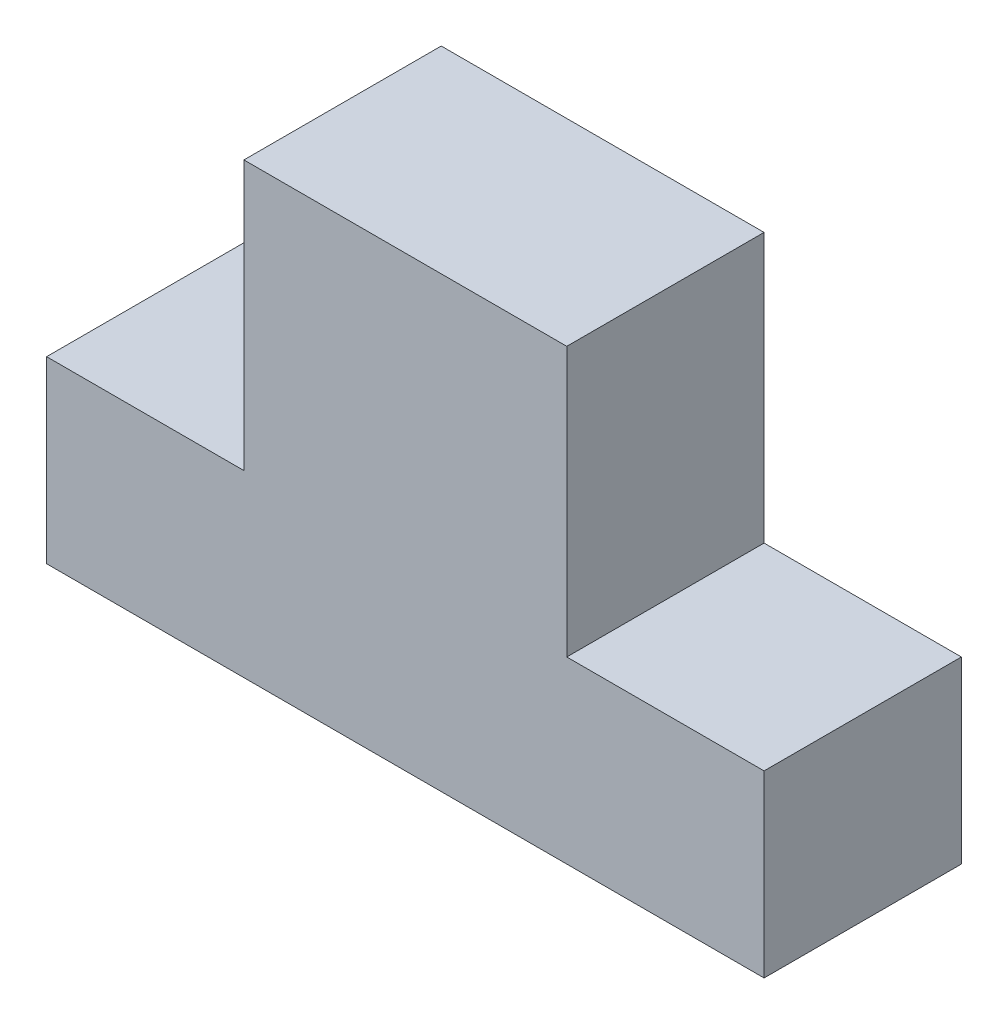
from build123d import *

# Parameters (mm, degrees)
EXTRUDE_1_DEPTH = 5.5


with BuildPart() as part:
    # ｽｹｯﾁ1 → ﾎﾞｽ - 押し出し1 (new body)
    with BuildSketch(Plane.XY):
        Polygon((-10, 0), (10, 0), (10, 5), (4.5, 5), (4.5, 12.5), (-4.5, 12.5), (-4.5, 5), (-10, 5), align=None)
    extrude(amount=EXTRUDE_1_DEPTH)


solid = part.part
